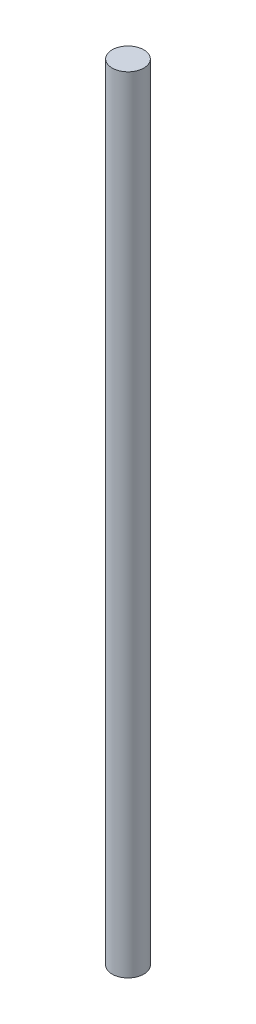
from build123d import *


with BuildPart() as part:
    # 草图1 → 旋转1 (revolve)
    with BuildSketch(Plane.XY):
        Polygon((0, 0), (0, 40), (0, 44.8), (-1, 44.8), (-1, -4.8), (0, -4.8), align=None)
    revolve(axis=Axis((0, 67.586060676, 0), (0, -1, 0)))


solid = part.part
